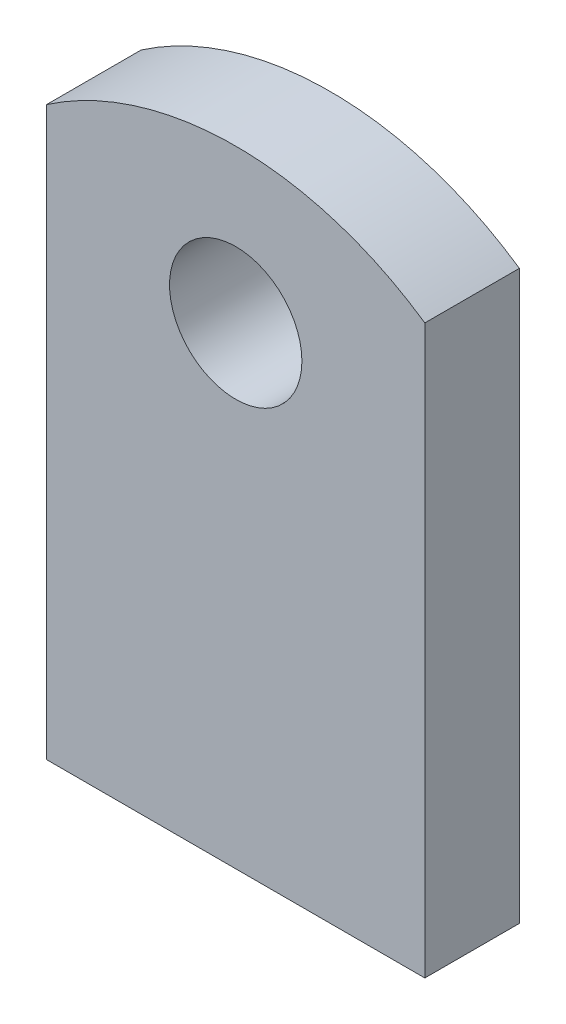
from build123d import *

# Parameters (mm, degrees)
SKETCH1_R           = 3.5
BOSS_EXTRUDE1_DEPTH = 5


with BuildPart() as part:
    # Sketch1 → Boss-Extrude1 (new body)
    with BuildSketch(Plane.XY):
        with BuildLine():
            Line((10, -15), (-10, -15))
            Line((-10, -15), (-10, 15))
            ThreePointArc((-10, 15), (0, 18.09979424), (10, 15))
            Line((10, 15), (10, -15))
        make_face()
        with Locations((0, 10)):
            Circle(SKETCH1_R, mode=Mode.SUBTRACT)
    extrude(amount=BOSS_EXTRUDE1_DEPTH)


solid = part.part
